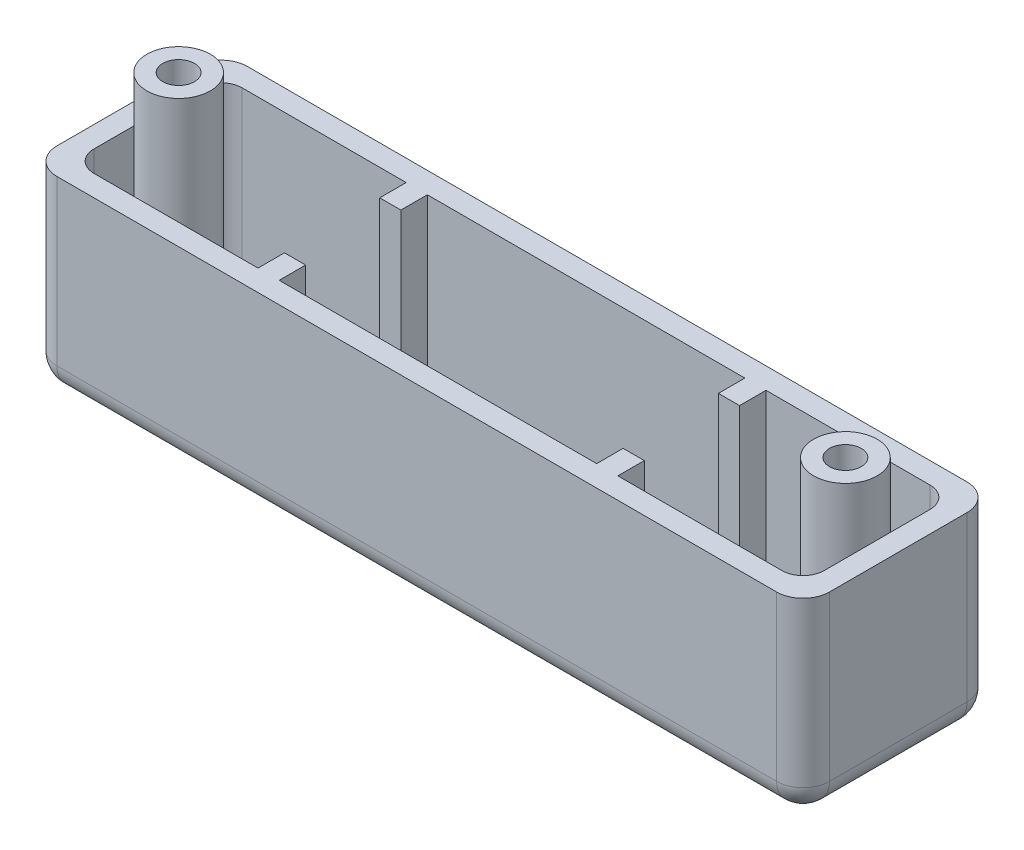
from build123d import *

# Parameters (mm, degrees)
SKETCH1_W             = 37.084
SKETCH1_H             = 9.144
BOSS_EXTRUDE1_DEPTH   = 9.144
SKETCH2_W             = 35.052
SKETCH2_H             = 7.112
CUT_EXTRUDE3_DEPTH    = 7.493
FILLET1_R             = 1.27
FILLET2_R             = 1.016
SKETCH10_W            = 1.016
SKETCH10_H            = 1.27
BOSS_EXTRUDE5_DEPTH   = 7.493
SKETCH11_R            = 1.524
BOSS_EXTRUDE8_DEPTH   = 10.16
BOSS_EXTRUDE8_2_DEPTH = 10.16
SKETCH12_R            = 0.762
CUT_EXTRUDE4_DEPTH    = 5.08


with BuildPart() as part:
    # Sketch1 → Boss-Extrude1 (new body)
    with BuildSketch(Plane(origin=(0, 0, 0), x_dir=(1, 0, 0), z_dir=(0, 1, 0))):
        Rectangle(SKETCH1_W, SKETCH1_H)
    extrude(amount=BOSS_EXTRUDE1_DEPTH)

    # Sketch2 → Cut-Extrude3 (cut)
    with BuildSketch(Plane(origin=(0, 9.144, 0), x_dir=(1, 0, 0), z_dir=(0, 1, 0))):
        Rectangle(SKETCH2_W, SKETCH2_H)
    extrude(amount=-CUT_EXTRUDE3_DEPTH, mode=Mode.SUBTRACT)

    # Fillet1
    fillet1_edges = [part.edges().sort_by_distance(p)[0] for p in [
        (0, 0, 4.572),
        (-18.542, 0, 0),
        (0, 0, -4.572),
        (18.542, 0, 0),
        (18.542, 4.572, 4.572),
        (-18.542, 4.572, 4.572),
        (-18.542, 4.572, -4.572),
        (18.542, 4.572, -4.572),
    ]]
    fillet(fillet1_edges, radius=FILLET1_R)

    # Fillet2
    fillet2_edges = [part.edges().sort_by_distance(p)[0] for p in [
        (-17.526, 5.3975, -3.556),
        (-17.526, 5.3975, 3.556),
        (17.526, 5.3975, 3.556),
        (17.526, 5.3975, -3.556),
    ]]
    fillet(fillet2_edges, radius=FILLET2_R)

    # Sketch10 → Boss-Extrude5 (add)
    with BuildSketch(Plane(origin=(0, 1.651, 0), x_dir=(1, 0, 0), z_dir=(0, 1, 0))):
        with Locations((-8.128, 2.921)):
            Rectangle(SKETCH10_W, SKETCH10_H)
        with Locations((8.128, 2.921)):
            Rectangle(SKETCH10_W, SKETCH10_H)
        with Locations((-8.128, -2.921)):
            Rectangle(SKETCH10_W, SKETCH10_H)
        with Locations((8.128, -2.921)):
            Rectangle(SKETCH10_W, SKETCH10_H)
    extrude(amount=BOSS_EXTRUDE5_DEPTH)


with BuildPart() as body_2:
    # Sketch11 → Boss-Extrude8 (new body)
    with BuildSketch(Plane(origin=(0, 1.651, 0), x_dir=(1, 0, 0), z_dir=(0, 1, 0))):
        with Locations(Location((16.002, 0, 0), (0, 0, 270))):
            Circle(SKETCH11_R)
    extrude(amount=BOSS_EXTRUDE8_DEPTH)


with BuildPart() as body_3:
    # Sketch11 → Boss-Extrude8 2 (new body)
    with BuildSketch(Plane(origin=(0, 1.651, 0), x_dir=(1, 0, 0), z_dir=(0, 1, 0))):
        with Locations(Location((-16.002, 0, 0), (0, 0, 270))):
            Circle(SKETCH11_R)
    extrude(amount=BOSS_EXTRUDE8_2_DEPTH)


with BuildPart() as cut_extrude4_tool:
    # Sketch12 → Cut-Extrude4 (new body)
    with BuildSketch(Plane(origin=(0, 11.811, 0), x_dir=(1, 0, 0), z_dir=(0, 1, 0))):
        with Locations(Location((-16.002, 0, 0), (0, 0, 270))):
            Circle(SKETCH12_R)
        with Locations(Location((16.002, 0, 0), (0, 0, 270))):
            Circle(SKETCH12_R)
    extrude(amount=-CUT_EXTRUDE4_DEPTH)


with BuildPart() as body_2_1:
    add(body_2.part)

    # Cut-Extrude4: cut by cut_extrude4_tool
    add(cut_extrude4_tool.part, mode=Mode.SUBTRACT)


with BuildPart() as body_3_1:
    add(body_3.part)

    # Cut-Extrude4: cut by cut_extrude4_tool
    add(cut_extrude4_tool.part, mode=Mode.SUBTRACT)


solid = Compound([part.part, body_2_1.part, body_3_1.part])
